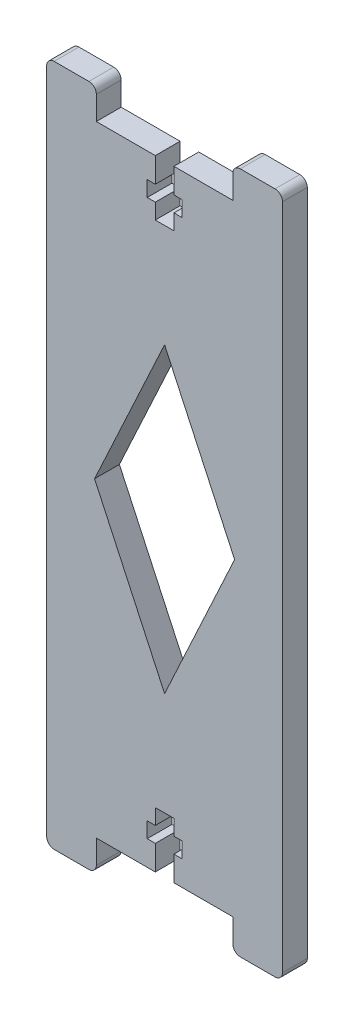
from build123d import *

# Parameters (mm, degrees)
EXTRUDE_1_DEPTH = 4
FILLET_1_R      = 1.2


with BuildPart() as part:
    # 草图1 → 凸台-拉伸1 (new body)
    with BuildSketch(Plane.XY):
        Polygon((14.909090909, 14), (14.909090909, -96), (6.909090909, -96), (6.909090909, -91), (-2.590909091, -91), (-2.590909091, -87), (-1.290909091, -87), (-1.290909091, -84.5), (-2.590909091, -84.5), (-2.590909091, -82), (-5.590909091, -82), (-5.590909091, -84.5), (-6.890909091, -84.5), (-6.890909091, -87), (-5.590909091, -87), (-5.590909091, -91), (-15.090909091, -91), (-15.090909091, -96), (-23.090909091, -96), (-23.090909091, 14), (-15.090909091, 14), (-15.090909091, 9), (-5.590909091, 9), (-5.590909091, 5), (-6.890909091, 5), (-6.890909091, 2.5), (-5.590909091, 2.5), (-5.590909091, 0), (-2.590909091, 0), (-2.590909091, 2.5), (-1.290909091, 2.5), (-1.290909091, 5), (-2.590909091, 5), (-2.590909091, 9), (6.909090909, 9), (6.909090909, 14), align=None)
        Polygon((-4.090909091, -16.648392567), (-15.37580034, -41), (-4.090909091, -65.351607433), (7.193982158, -41), align=None, mode=Mode.SUBTRACT)
    extrude(amount=EXTRUDE_1_DEPTH)

    # 圆角1
    fillet_1_edges = [part.edges().sort_by_distance(p)[0] for p in [
        (6.909090909, 14, 2),
        (14.909090909, 14, 2),
        (14.909090909, -96, 2),
        (6.909090909, -96, 2),
        (-15.090909091, -96, 2),
        (-23.090909091, -96, 2),
        (-23.090909091, 14, 2),
        (-15.090909091, 14, 2),
    ]]
    fillet(fillet_1_edges, radius=FILLET_1_R)


solid = part.part
